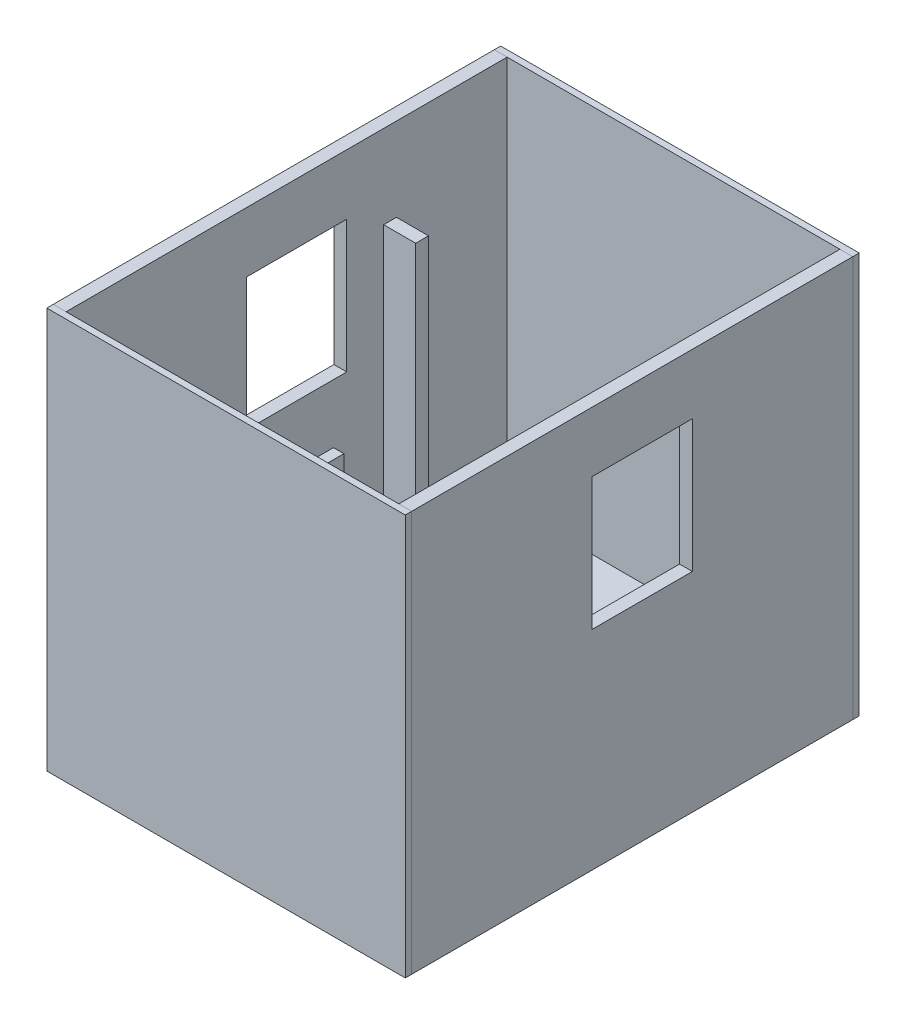
from build123d import *

# Parameters (mm, degrees)
ESQUISSE1_W             = 415
ESQUISSE1_H             = 550
BOSS_EXTRU_1_DEPTH      = 16
BOSS_EXTRU_2_START      = 40
ESQUISSE2_W             = 13
ESQUISSE2_H             = 27
BOSS_EXTRU_2_DEPTH      = 335
BOSS_EXTRU_2_2_DEPTH    = 335
ESQUISSE3_W             = 16
ESQUISSE3_H             = 550
BOSS_EXTRU_3_DEPTH      = 500
BOSS_EXTRU_3_2_DEPTH    = 500
ESQUISSE4_W             = 125
ESQUISSE4_H             = 165
ENL_V_MAT_EXTRU_1_DEPTH = 868.357481088
ESQUISSE5_W             = 415
ESQUISSE5_H             = 16
BOSS_EXTRU_4_DEPTH      = 320
ESQUISSE6_W             = 447
ESQUISSE6_H             = 500
BOSS_EXTRU_5_DEPTH      = 8
ESQUISSE7_W             = 447
ESQUISSE7_H             = 500
BOSS_EXTRU_6_DEPTH      = 8
ESQUISSE9_W             = 40
ESQUISSE9_H             = 16
BOSS_EXTRU_8_DEPTH      = 380
BOSS_EXTRU_8_2_DEPTH    = 380
ESQUISSE10_W            = 16
ESQUISSE10_H            = 141
BOSS_EXTRU_9_DEPTH      = 180
ESQUISSE11_W            = 13
ESQUISSE11_H            = 27
BOSS_EXTRU_10_DEPTH     = 320
BOSS_EXTRU_10_2_DEPTH   = 320


with BuildPart() as part:
    # Esquisse1 → Boss.-Extru.1 (new body)
    with BuildSketch(Plane(origin=(0, 0, 0), x_dir=(1, 0, 0), z_dir=(0, 1, 0))):
        with Locations((207.5, 275)):
            Rectangle(ESQUISSE1_W, ESQUISSE1_H)
    extrude(amount=BOSS_EXTRU_1_DEPTH)


with BuildPart() as body_2:
    # Esquisse2 → Boss.-Extru.2 (new body)
    with BuildSketch(Plane(origin=(0, 0, -500), x_dir=(0, 0, -1), z_dir=(1, 0, 0)).offset(BOSS_EXTRU_2_START)):
        with Locations((-201.5, 29.5)):
            Rectangle(ESQUISSE2_W, ESQUISSE2_H)
    extrude(amount=BOSS_EXTRU_2_DEPTH)


with BuildPart() as body_3:
    # Esquisse2 → Boss.-Extru.2 2 (new body)
    with BuildSketch(Plane(origin=(0, 0, -500), x_dir=(0, 0, -1), z_dir=(1, 0, 0)).offset(BOSS_EXTRU_2_START)):
        with Locations((-94.5, 29.5)):
            Rectangle(ESQUISSE2_W, ESQUISSE2_H)
    extrude(amount=BOSS_EXTRU_2_2_DEPTH)


with BuildPart() as body_4:
    # Esquisse3 → Boss.-Extru.3 (new body)
    with BuildSketch(Plane(origin=(0, 0, 0), x_dir=(1, 0, 0), z_dir=(0, 1, 0))):
        with Locations((-8, 275)):
            Rectangle(ESQUISSE3_W, ESQUISSE3_H)
    extrude(amount=BOSS_EXTRU_3_DEPTH)


with BuildPart() as body_5:
    # Esquisse3 → Boss.-Extru.3 2 (new body)
    with BuildSketch(Plane(origin=(0, 0, 0), x_dir=(1, 0, 0), z_dir=(0, 1, 0))):
        with Locations((423, 275)):
            Rectangle(ESQUISSE3_W, ESQUISSE3_H)
    extrude(amount=BOSS_EXTRU_3_2_DEPTH)


with BuildPart() as enl_v_mat_extru_1_tool:
    # Esquisse4 → Enlèv. mat.-Extru.1 (new, through all)
    with BuildSketch(Plane.ZY.offset(16)):
        with Locations((-287.5, 342.5)):
            Rectangle(ESQUISSE4_W, ESQUISSE4_H)
    extrude(amount=-ENL_V_MAT_EXTRU_1_DEPTH)


with BuildPart() as body_4_1:
    add(body_4.part)

    # Enlèv. mat.-Extru.1: cut by enl_v_mat_extru_1_tool
    add(enl_v_mat_extru_1_tool.part, mode=Mode.SUBTRACT)


with BuildPart() as body_5_1:
    add(body_5.part)

    # Enlèv. mat.-Extru.1: cut by enl_v_mat_extru_1_tool
    add(enl_v_mat_extru_1_tool.part, mode=Mode.SUBTRACT)


with BuildPart() as body_6:
    # Esquisse5 → Boss.-Extru.4 (new body)
    with BuildSketch(Plane(origin=(0, 16, 0), x_dir=(1, 0, 0), z_dir=(0, 1, 0))):
        with Locations((207.5, 149)):
            Rectangle(ESQUISSE5_W, ESQUISSE5_H)
    extrude(amount=BOSS_EXTRU_4_DEPTH)


with BuildPart() as body_7:
    # Esquisse6 → Boss.-Extru.5 (new body)
    with BuildSketch(Plane(origin=(0, 0, -550), x_dir=(-1, 0, 0), z_dir=(0, 0, -1))):
        with Locations((-207.5, 250)):
            Rectangle(ESQUISSE6_W, ESQUISSE6_H)
    extrude(amount=BOSS_EXTRU_5_DEPTH)


with BuildPart() as body_8:
    # Esquisse7 → Boss.-Extru.6 (new body)
    with BuildSketch(Plane.XY):
        with Locations((207.5, 250)):
            Rectangle(ESQUISSE7_W, ESQUISSE7_H)
    extrude(amount=BOSS_EXTRU_6_DEPTH)


with BuildPart() as body_9:
    # Esquisse9 → Boss.-Extru.8 (new body)
    with BuildSketch(Plane(origin=(0, 16, 0), x_dir=(1, 0, 0), z_dir=(0, 1, 0))):
        with Locations((20, 404)):
            Rectangle(ESQUISSE9_W, ESQUISSE9_H)
    extrude(amount=BOSS_EXTRU_8_DEPTH)


with BuildPart() as body_10:
    # Esquisse9 → Boss.-Extru.8 2 (new body)
    with BuildSketch(Plane(origin=(0, 16, 0), x_dir=(1, 0, 0), z_dir=(0, 1, 0))):
        with Locations((395, 404)):
            Rectangle(ESQUISSE9_W, ESQUISSE9_H)
    extrude(amount=BOSS_EXTRU_8_2_DEPTH)


with BuildPart() as body_11:
    # Esquisse10 → Boss.-Extru.9 (new body)
    with BuildSketch(Plane(origin=(0, 16, 0), x_dir=(1, 0, 0), z_dir=(0, 1, 0))):
        with Locations((113, 70.5)):
            Rectangle(ESQUISSE10_W, ESQUISSE10_H)
    extrude(amount=BOSS_EXTRU_9_DEPTH)


with BuildPart() as body_12:
    # Esquisse11 → Boss.-Extru.10 (new body)
    with BuildSketch(Plane(origin=(0, 16, 0), x_dir=(1, 0, 0), z_dir=(0, 1, 0))):
        with Locations((156, 170.5)):
            Rectangle(ESQUISSE11_W, ESQUISSE11_H)
    extrude(amount=BOSS_EXTRU_10_DEPTH)


with BuildPart() as body_13:
    # Esquisse11 → Boss.-Extru.10 2 (new body)
    with BuildSketch(Plane(origin=(0, 16, 0), x_dir=(1, 0, 0), z_dir=(0, 1, 0))):
        with Locations((259, 170.5)):
            Rectangle(ESQUISSE11_W, ESQUISSE11_H)
    extrude(amount=BOSS_EXTRU_10_2_DEPTH)


solid = Compound([part.part, body_2.part, body_3.part, body_4_1.part, body_5_1.part, body_6.part, body_7.part, body_8.part, body_9.part, body_10.part, body_11.part, body_12.part, body_13.part])
